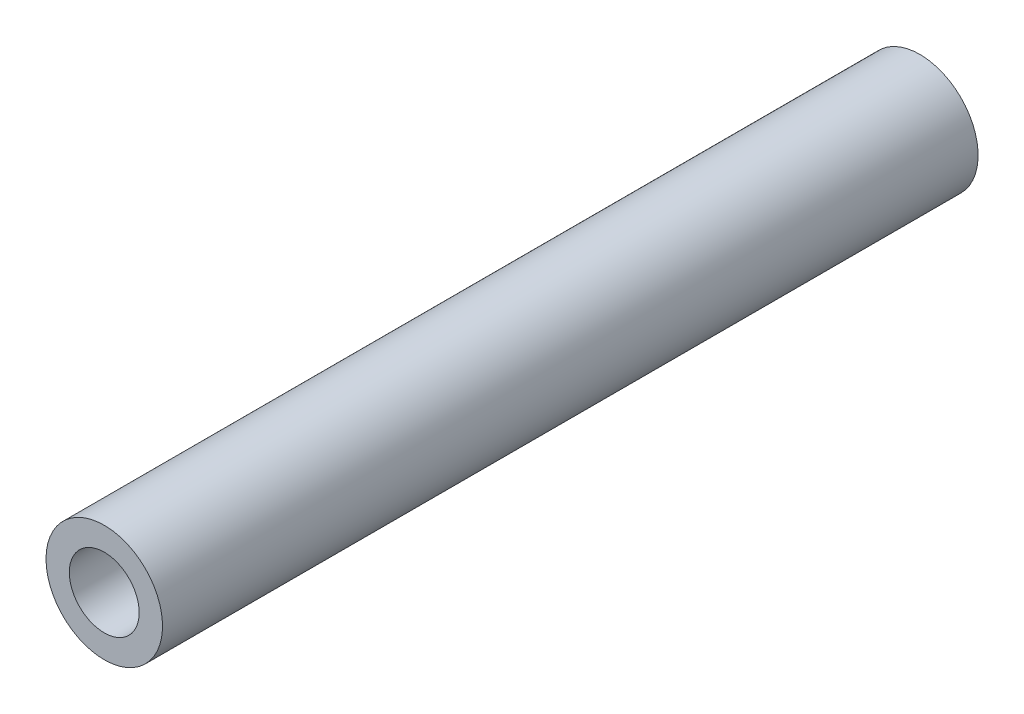
from build123d import *

# Parameters (mm, degrees)
SKETCH1_R           = 1.5
SKETCH1_R_2         = 0.9
BOSS_EXTRUDE1_DEPTH = 21


with BuildPart() as part:
    # Sketch1 → Boss-Extrude1 (new body)
    with BuildSketch(Plane.XY):
        with Locations(Location((0, 0, 0), (0, 0, 180))):
            Circle(SKETCH1_R)
        with Locations(Location((0, 0, 0), (0, 0, 180))):
            Circle(SKETCH1_R_2, mode=Mode.SUBTRACT)
    extrude(amount=BOSS_EXTRUDE1_DEPTH)


solid = part.part
